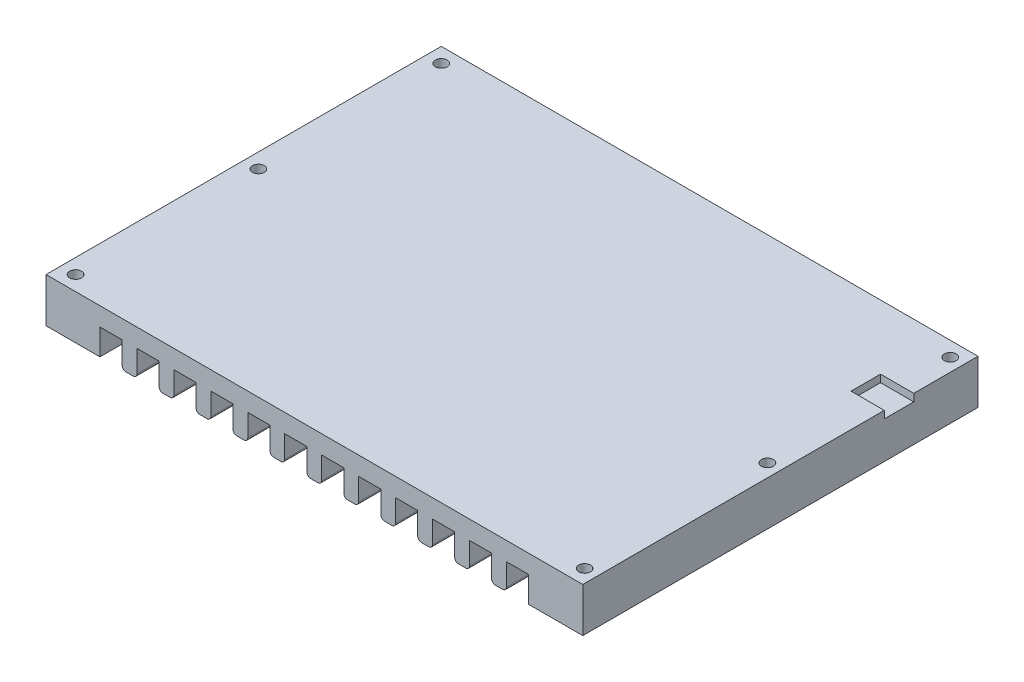
from build123d import *

# Parameters (mm, degrees)
EXTRUDE_2_DEPTH     = 6
SKETCH_1_6_W        = 4.5
SKETCH_1_6_H        = 3.99
CUT_EXTRUDE_1_DEPTH = 1
SKETCH_1_7_R        = 0.8
CUT_EXTRUDE_2_DEPTH = 6
SKETCH_1_8_R        = 0.8
CUT_EXTRUDE_3_DEPTH = 6
SKETCH_2_W          = 3
SKETCH_2_H          = 3.5
CUT_EXTRUDE_5_DEPTH = 60
FILLET_1_R          = 0.5


with BuildPart() as part:
    # 草图1 → 凸台-拉伸2 (new body)
    with BuildSketch(Plane(origin=(0, 0, 0), x_dir=(1, 0, 0), z_dir=(0, 1, 0))):
        Polygon((0, 0), (72.63, 0), (72.63, 40.8), (72.63, 44.79), (72.63, 53.48), (0, 53.48), align=None)
    extrude(amount=-EXTRUDE_2_DEPTH)

    # 草图1<6> → 切除-拉伸1 (cut)
    with BuildSketch(Plane(origin=(0, 0, 0), x_dir=(1, 0, 0), z_dir=(0, 1, 0))):
        with Locations((70.38, 42.795)):
            Rectangle(SKETCH_1_6_W, SKETCH_1_6_H)
    extrude(amount=-CUT_EXTRUDE_1_DEPTH, mode=Mode.SUBTRACT)

    # 草图1<7> → 切除-拉伸2 (cut)
    with BuildSketch(Plane(origin=(0, 0, 0), x_dir=(1, 0, 0), z_dir=(0, 1, 0))):
        with Locations((2, 2)):
            Circle(SKETCH_1_7_R)
        with Locations((70.879, 2)):
            Circle(SKETCH_1_7_R)
        with Locations((2, 51.48)):
            Circle(SKETCH_1_7_R)
        with Locations((70.879, 51.48)):
            Circle(SKETCH_1_7_R)
    extrude(amount=-CUT_EXTRUDE_2_DEPTH, mode=Mode.SUBTRACT)

    # 草图1<8> → 切除-拉伸3 (cut)
    with BuildSketch(Plane(origin=(0, 0, 0), x_dir=(1, 0, 0), z_dir=(0, 1, 0))):
        with Locations((2, 26.74)):
            Circle(SKETCH_1_8_R)
        with Locations((70.879, 26.74)):
            Circle(SKETCH_1_8_R)
    extrude(amount=-CUT_EXTRUDE_3_DEPTH, mode=Mode.SUBTRACT)

    # 草图2 → 切除-拉伸5 (cut)
    with BuildSketch(Plane.XY):
        with Locations((63.8, -4.25)):
            Rectangle(SKETCH_2_W, SKETCH_2_H)
        with Locations((58.8, -4.25)):
            Rectangle(SKETCH_2_W, SKETCH_2_H)
        with Locations((53.8, -4.25)):
            Rectangle(SKETCH_2_W, SKETCH_2_H)
        with Locations((48.8, -4.25)):
            Rectangle(SKETCH_2_W, SKETCH_2_H)
        with Locations((43.8, -4.25)):
            Rectangle(SKETCH_2_W, SKETCH_2_H)
        with Locations((38.8, -4.25)):
            Rectangle(SKETCH_2_W, SKETCH_2_H)
        with Locations((33.8, -4.25)):
            Rectangle(SKETCH_2_W, SKETCH_2_H)
        with Locations((28.8, -4.25)):
            Rectangle(SKETCH_2_W, SKETCH_2_H)
        with Locations((23.8, -4.25)):
            Rectangle(SKETCH_2_W, SKETCH_2_H)
        with Locations((18.8, -4.25)):
            Rectangle(SKETCH_2_W, SKETCH_2_H)
        with Locations((13.8, -4.25)):
            Rectangle(SKETCH_2_W, SKETCH_2_H)
        with Locations((8.8, -4.25)):
            Rectangle(SKETCH_2_W, SKETCH_2_H)
    extrude(amount=-CUT_EXTRUDE_5_DEPTH, mode=Mode.SUBTRACT)

    # 圆角1
    fillet_1_edges = [part.edges().sort_by_distance(p)[0] for p in [
        (12.3, -6, -26.74),
        (10.3, -6, -26.74),
        (15.3, -6, -26.74),
        (17.3, -6, -26.74),
        (20.3, -6, -26.74),
        (22.3, -6, -26.74),
        (25.3, -6, -26.74),
        (27.3, -6, -26.74),
        (30.3, -6, -26.74),
        (32.3, -6, -26.74),
        (35.3, -6, -26.74),
        (37.3, -6, -26.74),
        (40.3, -6, -26.74),
        (42.3, -6, -26.74),
        (45.3, -6, -26.74),
        (47.3, -6, -26.74),
        (50.3, -6, -26.74),
        (52.3, -6, -26.74),
        (55.3, -6, -26.74),
        (57.3, -6, -26.74),
        (60.3, -6, -26.74),
        (62.3, -6, -26.74),
    ]]
    fillet(fillet_1_edges, radius=FILLET_1_R)


solid = part.part
